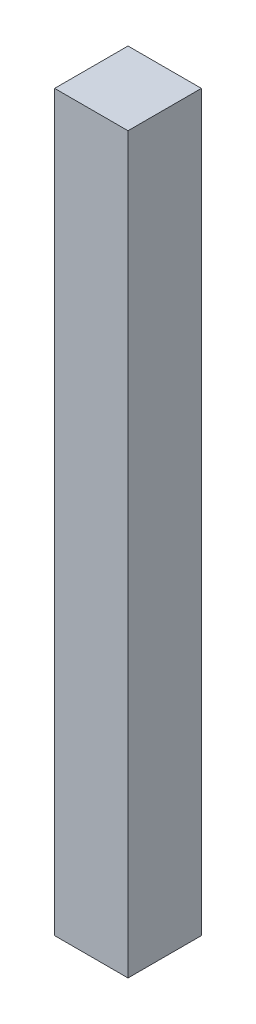
from build123d import *

# Parameters (mm, degrees)
SKIZZE2_W                       = 20
SKIZZE2_H                       = 20
AUFSATZ_LINEAR_AUSTRAGEN1_DEPTH = 200


with BuildPart() as part:
    # Skizze2 → Aufsatz-Linear austragen1 (new body)
    with BuildSketch(Plane(origin=(0, 0, 0), x_dir=(1, 0, 0), z_dir=(0, 1, 0))):
        Rectangle(SKIZZE2_W, SKIZZE2_H)
    extrude(amount=AUFSATZ_LINEAR_AUSTRAGEN1_DEPTH)


solid = part.part
